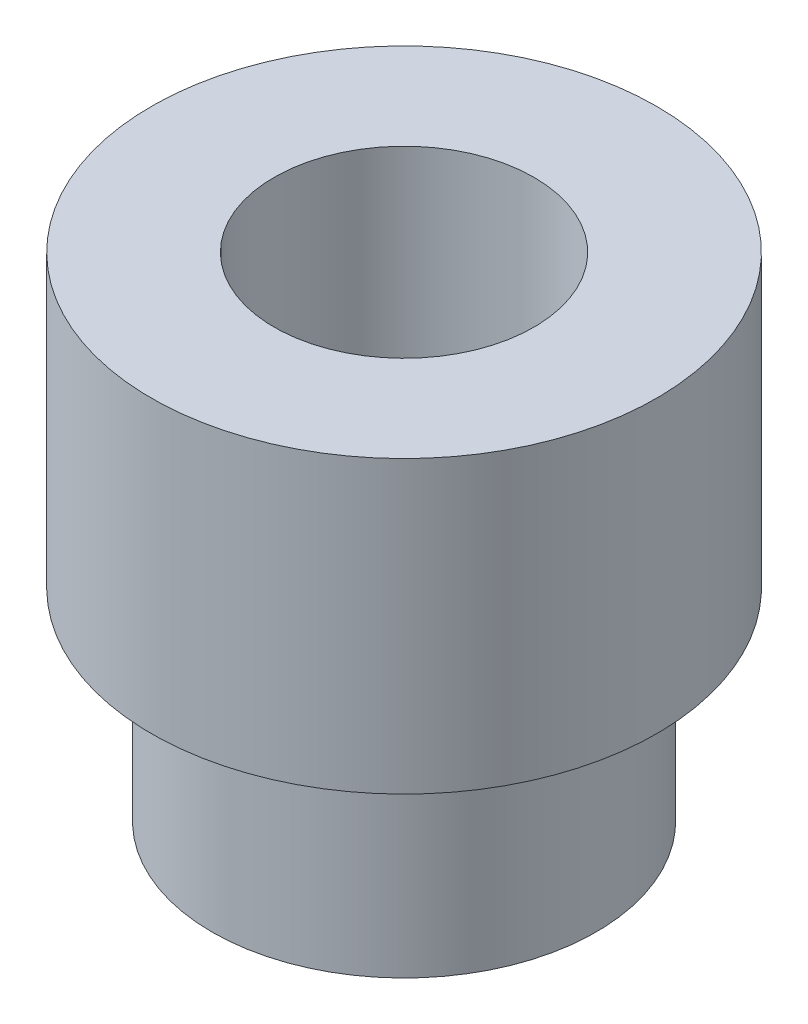
from build123d import *

# Parameters (mm, degrees)
SKETCH1_R           = 6.35
SKETCH1_R_2         = 3.2639
BOSS_EXTRUDE1_DEPTH = 7.3025
BOSS_EXTRUDE2_START = -5.08
SKETCH1_3_R         = 4.826
SKETCH1_3_R_2       = 3.2639
BOSS_EXTRUDE2_DEPTH = 5.08


with BuildPart() as part:
    # Sketch1 → Boss-Extrude1 (new body)
    with BuildSketch(Plane(origin=(0, 0, 0), x_dir=(1, 0, 0), z_dir=(0, 1, 0))):
        Circle(SKETCH1_R)
        Circle(SKETCH1_R_2, mode=Mode.SUBTRACT)
    extrude(amount=BOSS_EXTRUDE1_DEPTH)

    # Sketch1<3> → Boss-Extrude2 (add)
    with BuildSketch(Plane(origin=(0, 0, 0), x_dir=(1, 0, 0), z_dir=(0, 1, 0)).offset(BOSS_EXTRUDE2_START)):
        Circle(SKETCH1_3_R)
        Circle(SKETCH1_3_R_2, mode=Mode.SUBTRACT)
    extrude(amount=BOSS_EXTRUDE2_DEPTH)


solid = part.part
